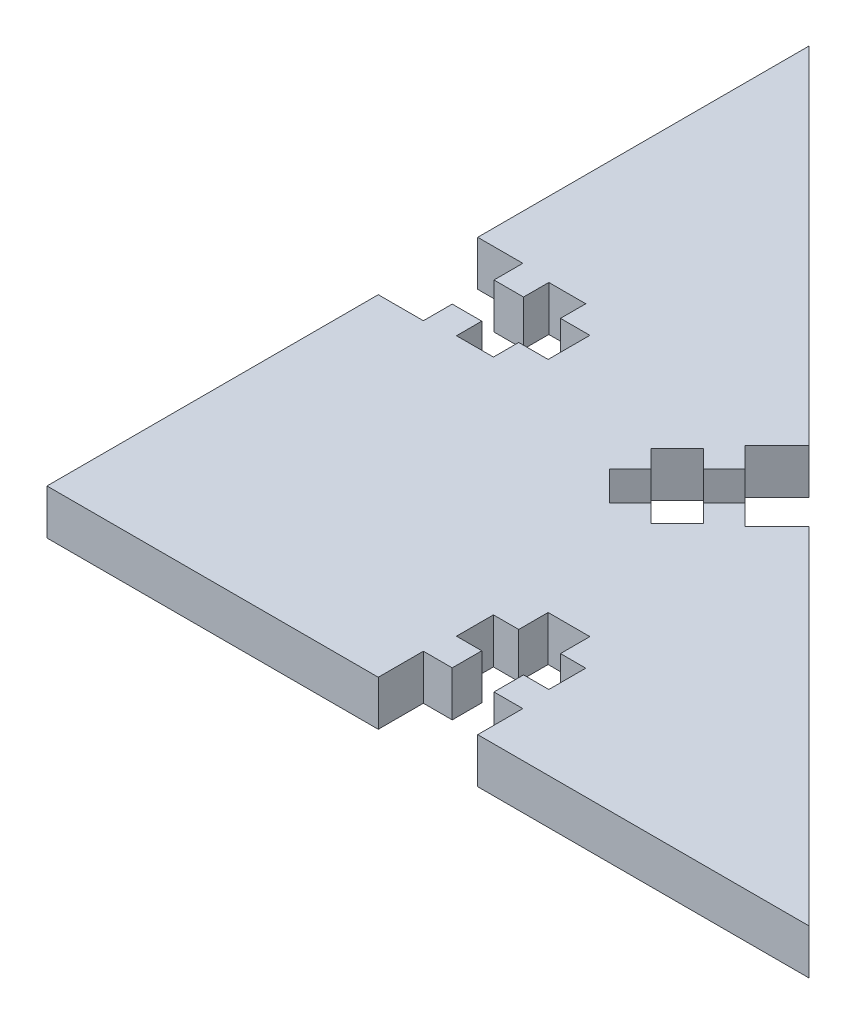
from build123d import *

# Parameters (mm, degrees)
BOSS_EXTRUDE1_DEPTH = 3.175
CUT_EXTRUDE1_DEPTH  = 10


with BuildPart() as part:
    # Sketch1 → Boss-Extrude1 (new body)
    with BuildSketch(Plane(origin=(0, 0, 0), x_dir=(1, 0, 0), z_dir=(0, 1, 0))):
        Polygon((0, 0), (53.64, 0), (0, 53.64), align=None)
    extrude(amount=BOSS_EXTRUDE1_DEPTH)

    # Sketch2 → Cut-Extrude1 (cut)
    with BuildSketch(Plane(origin=(0, 3.175, 0), x_dir=(1, 0, 0), z_dir=(0, 1, 0))):
        Polygon((27.04627417, 22.096526702), (29.294873734, 24.345126266), (24.345126266, 29.294873734), (22.096526702, 27.04627417), (23.531953467, 25.610847404), (22.061171363, 24.140065299), (20.802521292, 25.39871537), (18.964043661, 23.560237739), (20.222693732, 22.301587668), (18.758982694, 20.837876631), (20.837876631, 18.758982694), (22.301587668, 20.222693732), (23.560237739, 18.964043661), (25.39871537, 20.802521292), (24.140065299, 22.061171363), (25.610847404, 23.531953467), align=None)
        Polygon((3.175, 30.32), (0, 30.32), (0, 23.32), (3.175, 23.32), (3.175, 25.35), (5.255, 25.35), (5.255, 23.57), (7.855, 23.57), (7.855, 25.35), (9.925, 25.35), (9.925, 28.29), (7.855, 28.29), (7.855, 30.07), (5.255, 30.07), (5.255, 28.29), (3.175, 28.29), align=None)
        Polygon((30.32, 3.175), (30.32, 0), (23.32, 0), (23.32, 3.175), (25.35, 3.175), (25.35, 5.255), (23.57, 5.255), (23.57, 7.855), (25.35, 7.855), (25.35, 9.925), (28.29, 9.925), (28.29, 7.855), (30.07, 7.855), (30.07, 5.255), (28.29, 5.255), (28.29, 3.175), align=None)
    extrude(amount=-CUT_EXTRUDE1_DEPTH, mode=Mode.SUBTRACT)


solid = part.part
